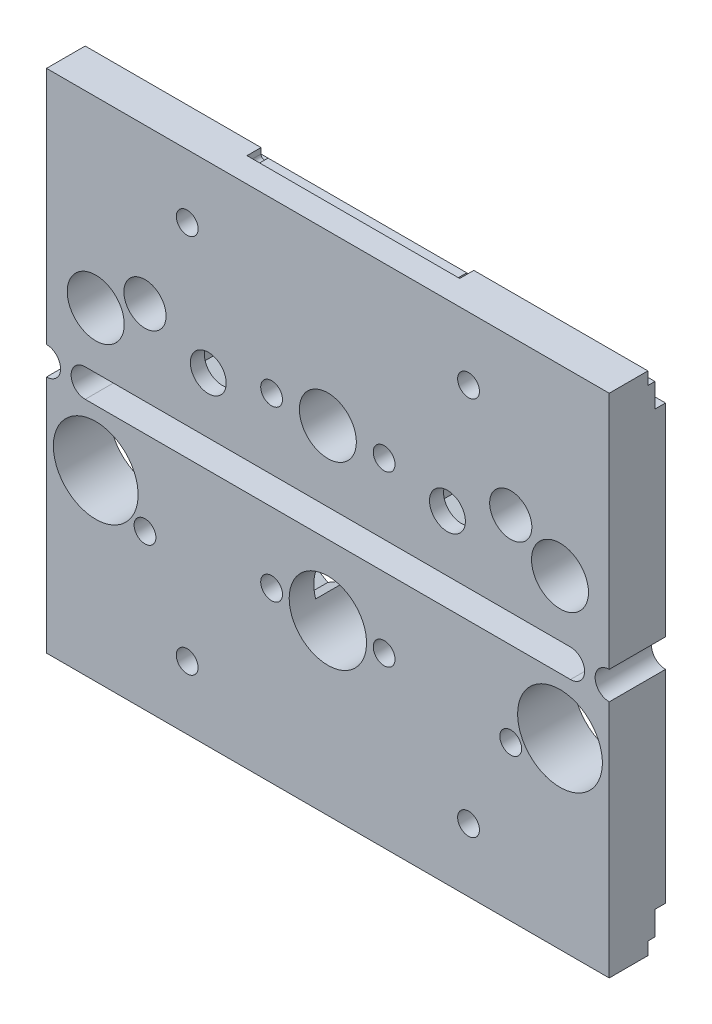
from build123d import *

# Parameters (mm, degrees)
SKETCH_2_W           = 80
SKETCH_2_H           = 34
SKETCH_2_R           = 4.05
EXTRUDE_1_DEPTH      = 8
SKETCH_3_R           = 2.55
CUT_EXTRUDE_1_DEPTH  = 88.292611371
CUT_EXTRUDE_2_DEPTH  = 88.292611371
SKETCH_5_R           = 1.55
CUT_EXTRUDE_3_DEPTH  = 88.292611371
CUT_EXTRUDE_5_DEPTH  = 4.5
SKETCH_25_R          = 1.55
CUT_EXTRUDE_13_DEPTH = 88.292611371
CUT_EXTRUDE_11_DEPTH = 2
EXTRUDE_2_DEPTH      = 8
SKETCH_26_R          = 6.025
CUT_EXTRUDE_14_DEPTH = 89.926936302
SKETCH_27_R          = 3
SKETCH_27_R_2        = 1.55
CUT_EXTRUDE_15_DEPTH = 89.926936302
CUT_EXTRUDE_16_DEPTH = 6
SKETCH_29_R          = 5.5
CUT_EXTRUDE_17_DEPTH = 89.926936302


with BuildPart() as part:
    # 草图2 → 凸台-拉伸1 (new body)
    with BuildSketch(Plane.XY):
        with Locations((40, 17)):
            Rectangle(SKETCH_2_W, SKETCH_2_H)
        with Locations((7, 8)):
            Circle(SKETCH_2_R, mode=Mode.SUBTRACT)
        with Locations((40, 10)):
            Circle(SKETCH_2_R, mode=Mode.SUBTRACT)
        with Locations((73, 8)):
            Circle(SKETCH_2_R, mode=Mode.SUBTRACT)
    extrude_1 = extrude(amount=EXTRUDE_1_DEPTH)

    # 草图3 → 切除-拉伸1 (cut, through all)
    with BuildSketch(Plane.XY.offset(8)):
        with Locations((23, 8)):
            Circle(SKETCH_3_R)
        with Locations((57, 8)):
            Circle(SKETCH_3_R)
    extrude(amount=-CUT_EXTRUDE_1_DEPTH, mode=Mode.SUBTRACT)

    # 草图4 → 切除-拉伸2 (cut, through all)
    with BuildSketch(Plane(origin=(80, 0, 0), x_dir=(0, 0, -1), z_dir=(1, 0, 0))):
        Polygon((-1.5, 32.2), (-2.5, 32.2), (-2.5, 34), (0, 34), (0, 28.8), (-1.5, 28.8), align=None)
    cut_extrude_2 = extrude(amount=-CUT_EXTRUDE_2_DEPTH, mode=Mode.SUBTRACT)

    # 草图5 → 切除-拉伸3 (cut, through all)
    with BuildSketch(Plane.XY.offset(8)):
        with Locations((48, 10)):
            Circle(SKETCH_5_R)
        with Locations((32, 10)):
            Circle(SKETCH_5_R)
    cut_extrude_3 = extrude(amount=-CUT_EXTRUDE_3_DEPTH, mode=Mode.SUBTRACT)

    # 草图8 → 切除-拉伸5 (cut)
    with BuildSketch(Plane(origin=(0, 0, 0), x_dir=(-1, 0, 0), z_dir=(0, 0, -1))):
        Polygon((-45.15, 8.354551733), (-45.15, 11.645448267), (-48, 13.290896534), (-50.85, 11.645448267), (-50.85, 8.354551733), (-48, 6.709103466), align=None)
        Polygon((-29.15, 8.354551733), (-29.15, 11.645448267), (-32, 13.290896534), (-34.85, 11.645448267), (-34.85, 8.354551733), (-32, 6.709103466), align=None)
    cut_extrude_5 = extrude(amount=-CUT_EXTRUDE_5_DEPTH, mode=Mode.SUBTRACT)

    # 草图25 → 切除-拉伸13 (cut, through all)
    with BuildSketch(Plane(origin=(0, 0, 0), x_dir=(-1, 0, 0), z_dir=(0, 0, -1))):
        with Locations((-60, 25)):
            Circle(SKETCH_25_R)
        with Locations((-20, 25)):
            Circle(SKETCH_25_R)
    cut_extrude_13 = extrude(amount=-CUT_EXTRUDE_13_DEPTH, mode=Mode.SUBTRACT)

    # 草图19 → 切除-拉伸11 (cut)
    with BuildSketch(Plane(origin=(0, 0, 2.5), x_dir=(-1, 0, 0), z_dir=(0, 0, -1))):
        with BuildLine():
            Line((-25, 34), (-55.247938178, 34))
            Line((-55.247938178, 34), (-55.247938178, 33.2))
            ThreePointArc((-55.247938178, 33.2), (-54.747938178, 32.7), (-54.247938178, 33.2))
            Line((-54.247938178, 33.2), (-26, 33.2))
            ThreePointArc((-26, 33.2), (-25.5, 32.7), (-25, 33.2))
            Line((-25, 33.2), (-25, 34))
        make_face()
    cut_extrude_11 = extrude(amount=-CUT_EXTRUDE_11_DEPTH, mode=Mode.SUBTRACT)

    # 草图22 → 凸台-拉伸2 (add)
    with BuildSketch(Plane.XY.offset(8)):
        with BuildLine():
            Line((0, -4), (5.5, -4))
            ThreePointArc((5.5, -4), (3.5, -2), (5.5, 0))
            Line((5.5, 0), (0, 0))
            ThreePointArc((0, 0), (2, -2), (0, -4))
        make_face()
        with BuildLine():
            Line((80, 0), (74.5, 0))
            ThreePointArc((74.5, 0), (76.5, -2), (74.5, -4))
            Line((74.5, -4), (80, -4))
            ThreePointArc((80, -4), (78, -2), (80, 0))
        make_face()
    extrude(amount=-EXTRUDE_2_DEPTH)

    # 镜向2: 凸台-拉伸1, 切除-拉伸2, 切除-拉伸3, 切除-拉伸5, 切除-拉伸13, 切除-拉伸11 across plane
    add(extrude_1.mirror(Plane(origin=(0, -2, 0), x_dir=(0, 0, 1), z_dir=(0, -1, 0))))
    add(cut_extrude_2.mirror(Plane(origin=(0, -2, 0), x_dir=(0, 0, 1), z_dir=(0, -1, 0))), mode=Mode.SUBTRACT)
    add(cut_extrude_3.mirror(Plane(origin=(0, -2, 0), x_dir=(0, 0, 1), z_dir=(0, -1, 0))), mode=Mode.SUBTRACT)
    add(cut_extrude_5.mirror(Plane(origin=(0, -2, 0), x_dir=(0, 0, 1), z_dir=(0, -1, 0))), mode=Mode.SUBTRACT)
    add(cut_extrude_13.mirror(Plane(origin=(0, -2, 0), x_dir=(0, 0, 1), z_dir=(0, -1, 0))), mode=Mode.SUBTRACT)
    add(cut_extrude_11.mirror(Plane(origin=(0, -2, 0), x_dir=(0, 0, 1), z_dir=(0, -1, 0))), mode=Mode.SUBTRACT)

    # 草图26 → 切除-拉伸14 (cut, through all)
    with BuildSketch(Plane(origin=(0, 0, 0), x_dir=(-1, 0, 0), z_dir=(0, 0, -1))):
        with Locations((-73, -12)):
            Circle(SKETCH_26_R)
        with Locations((-7, -12)):
            Circle(SKETCH_26_R)
    extrude(amount=-CUT_EXTRUDE_14_DEPTH, mode=Mode.SUBTRACT)

    # 草图27 → 切除-拉伸15 (cut, through all)
    with BuildSketch(Plane(origin=(0, 0, 0), x_dir=(-1, 0, 0), z_dir=(0, 0, -1))):
        with Locations((-66, 12)):
            Circle(SKETCH_27_R)
        with Locations((-66, -16)):
            Circle(SKETCH_27_R_2)
        with Locations((-14, -16)):
            Circle(SKETCH_27_R_2)
        with Locations((-14, 12)):
            Circle(SKETCH_27_R)
    extrude(amount=-CUT_EXTRUDE_15_DEPTH, mode=Mode.SUBTRACT)

    # 草图28 → 切除-拉伸16 (cut)
    with BuildSketch(Plane(origin=(0, 0, 0), x_dir=(-1, 0, 0), z_dir=(0, 0, -1))):
        Polygon((-52.9, 5.632863896), (-52.9, 10.367136104), (-57, 12.734272207), (-61.1, 10.367136104), (-61.1, 5.632863896), (-57, 3.265727793), align=None)
        Polygon((-18.9, 5.632863896), (-18.9, 10.367136104), (-23, 12.734272207), (-27.1, 10.367136104), (-27.1, 5.632863896), (-23, 3.265727793), align=None)
    extrude(amount=-CUT_EXTRUDE_16_DEPTH, mode=Mode.SUBTRACT)

    # 草图29 → 切除-拉伸17 (cut, through all)
    with BuildSketch(Plane(origin=(0, 0, 0), x_dir=(-1, 0, 0), z_dir=(0, 0, -1))):
        with Locations((-40, -14)):
            Circle(SKETCH_29_R)
    extrude(amount=-CUT_EXTRUDE_17_DEPTH, mode=Mode.SUBTRACT)


solid = part.part
